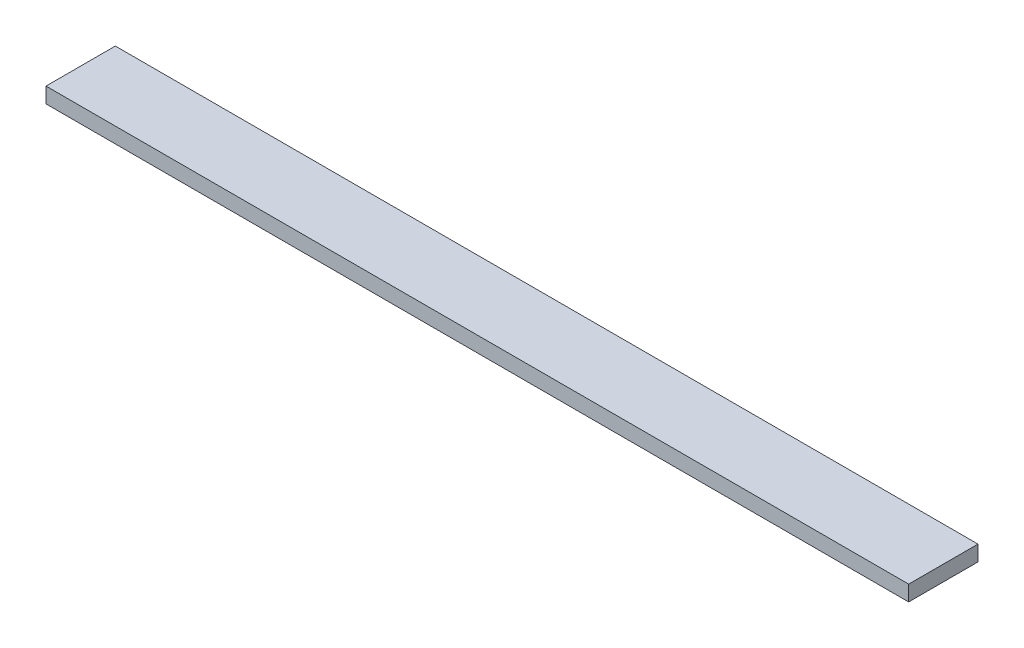
from build123d import *

# Parameters (mm, degrees)
SKETCH1_W           = 709
SKETCH1_H           = 56.98
BOSS_EXTRUDE1_DEPTH = 12.7
SKETCH2_R           = 2.0195
CUT_EXTRUDE1_DEPTH  = 12.7


with BuildPart() as part:
    # Sketch1 → Boss-Extrude1 (new body)
    with BuildSketch(Plane(origin=(0, 0, 0), x_dir=(1, 0, 0), z_dir=(0, 1, 0))):
        with Locations((354.5, 28.49)):
            Rectangle(SKETCH1_W, SKETCH1_H)
    extrude(amount=BOSS_EXTRUDE1_DEPTH)

    # Sketch2 → Cut-Extrude1 (cut)
    with BuildSketch(Plane(origin=(0, 0, -56.98), x_dir=(-1, 0, 0), z_dir=(0, 0, -1))):
        with Locations((-354.5, 6.35)):
            Circle(SKETCH2_R)
        with Locations((-10, 6.35)):
            Circle(SKETCH2_R)
        with Locations((-699, 6.35)):
            Circle(SKETCH2_R)
    extrude(amount=-CUT_EXTRUDE1_DEPTH, mode=Mode.SUBTRACT)


solid = part.part
